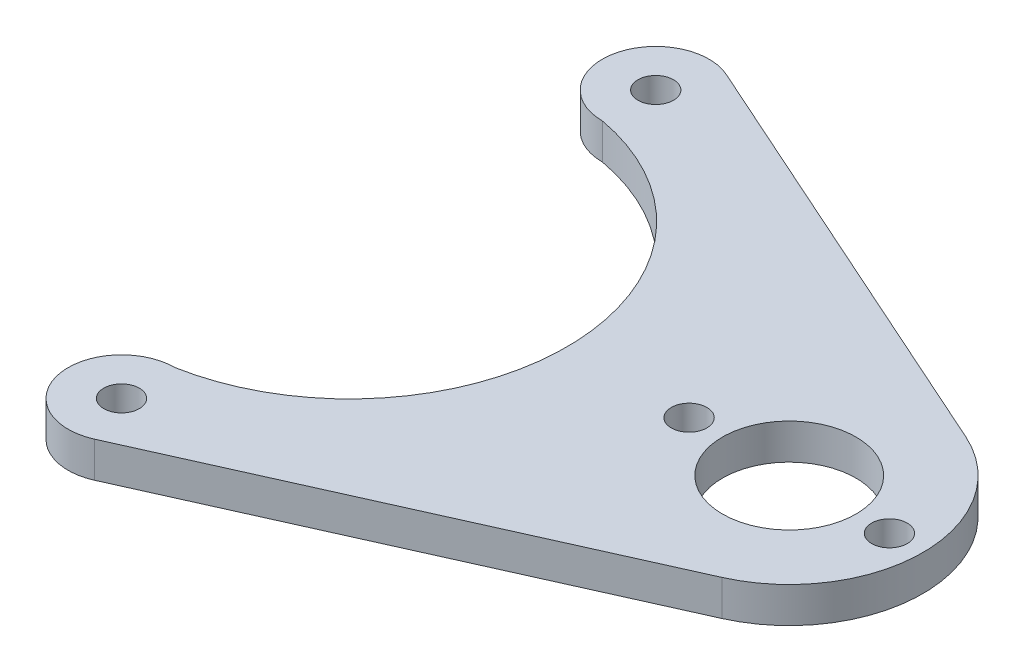
from build123d import *

# Parameters (mm, degrees)
SKETCH3_R           = 4
SKETCH3_R_2         = 15
BOSS_EXTRUDE1_DEPTH = 8


with BuildPart() as part:
    # Sketch3 → Boss-Extrude1 (new body)
    with BuildSketch(Plane(origin=(0, 0, 0), x_dir=(1, 0, 0), z_dir=(0, 1, 0))):
        with BuildLine():
            Line((-85.097948738, 70.953076893), (12.255128155, 27.382692233))
            ThreePointArc((12.255128155, 27.382692233), (30, 0), (12.255128155, -27.382692233))
            Line((12.255128155, -27.382692233), (-85.097948738, -70.953076893))
            ThreePointArc((-85.097948738, -70.953076893), (-101.735350926, -62.506299791), (-90, -48))
            ThreePointArc((-90, -48), (-50, 0), (-90, 48))
            ThreePointArc((-90, 48), (-101.735350926, 62.506299791), (-85.097948738, 70.953076893))
        make_face()
        with Locations(Location((-90, 60, 0), (0, 0, 270))):
            Circle(SKETCH3_R, mode=Mode.SUBTRACT)
        with Locations(Location((-90, -60, 0), (0, 0, 270))):
            Circle(SKETCH3_R, mode=Mode.SUBTRACT)
        with Locations(Location((22.5, 0, 0), (0, 0, 270))):
            Circle(SKETCH3_R, mode=Mode.SUBTRACT)
        with Locations(Location((-22.5, 0, 0), (0, 0, 270))):
            Circle(SKETCH3_R, mode=Mode.SUBTRACT)
        with Locations(Location((0, 0, 0), (0, 0, 270))):
            Circle(SKETCH3_R_2, mode=Mode.SUBTRACT)
    extrude(amount=BOSS_EXTRUDE1_DEPTH)


solid = part.part
